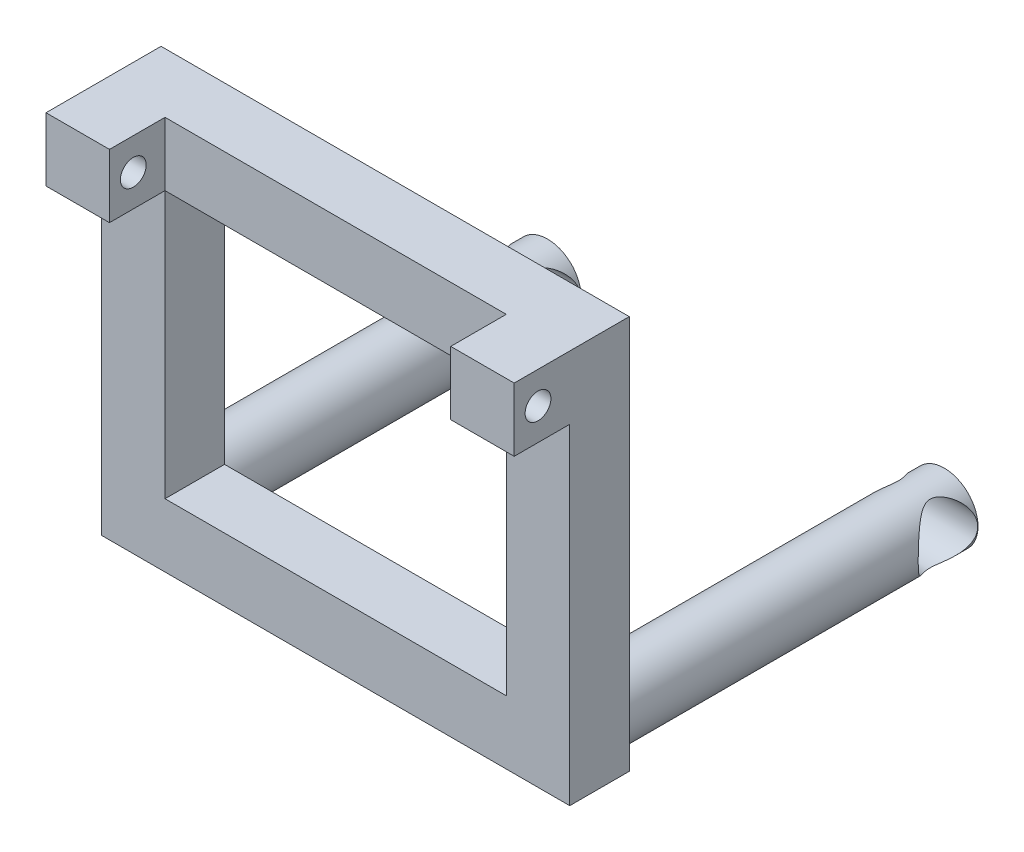
from build123d import *

# Parameters (mm, degrees)
SKETCH1_W           = 1180.071112
SKETCH1_H           = 992.574724554
SKETCH1_W_2         = 860.071112
SKETCH1_H_2         = 672.574724554
BOSS_EXTRUDE2_DEPTH = 150
SKETCH2_W           = 160
SKETCH2_H           = 160
BOSS_EXTRUDE3_DEPTH = 140
SKETCH4_R           = 85
BOSS_EXTRUDE4_DEPTH = 884
SKETCH5_R           = 75
CUT_EXTRUDE2_DEPTH  = 1704.724945294
SKETCH6_R           = 32.5
CUT_EXTRUDE3_DEPTH  = 1697.754922537


with BuildPart() as part:
    # Sketch1 → Boss-Extrude2 (new body)
    with BuildSketch(Plane.XY):
        with Locations((-366.347627568, -343.327690947)):
            Rectangle(SKETCH1_W, SKETCH1_H)
        with Locations((-366.347627568, -343.327690947)):
            Rectangle(SKETCH1_W_2, SKETCH1_H_2, mode=Mode.SUBTRACT)
    extrude(amount=BOSS_EXTRUDE2_DEPTH)

    # Sketch2 → Boss-Extrude3 (add)
    with BuildSketch(Plane.XY.offset(150)):
        with Locations((-876.383183568, 72.95967133)):
            Rectangle(SKETCH2_W, SKETCH2_H)
        with Locations((143.687928432, 72.95967133)):
            Rectangle(SKETCH2_W, SKETCH2_H)
    extrude(amount=BOSS_EXTRUDE3_DEPTH)

    # Sketch4 → Boss-Extrude4 (add)
    with BuildSketch(Plane(origin=(0, 0, 0), x_dir=(-1, 0, 0), z_dir=(0, 0, -1))):
        with Locations(Location((-133.687928432, -749.615053224, 0), (0, 0, 180))):
            Circle(SKETCH4_R)
        with Locations(Location((866.383183568, -749.615053224, 0), (0, 0, 180))):
            Circle(SKETCH4_R)
    extrude(amount=BOSS_EXTRUDE4_DEPTH)

    # Sketch5 → Cut-Extrude2 (cut, through all)
    with BuildSketch(Plane(origin=(233.687928432, 0, 0), x_dir=(0, 0, -1), z_dir=(1, 0, 0))):
        with Locations(Location((808.343239866, -749.615053224, 0), (0, 0, 90))):
            Circle(SKETCH5_R)
    extrude(amount=-CUT_EXTRUDE2_DEPTH, mode=Mode.SUBTRACT)

    # Sketch6 → Cut-Extrude3 (cut, through all)
    with BuildSketch(Plane(origin=(223.687928432, 0, 0), x_dir=(0, 0, -1), z_dir=(1, 0, 0))):
        with Locations(Location((-230, 72.95967133, 0), (0, 0, 90))):
            Circle(SKETCH6_R)
    extrude(amount=-CUT_EXTRUDE3_DEPTH, mode=Mode.SUBTRACT)


solid = part.part
